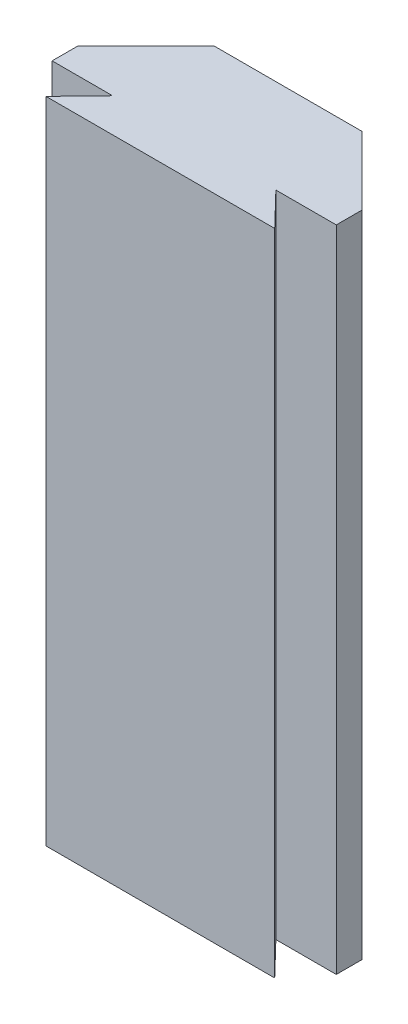
from build123d import *

# Parameters (mm, degrees)
BOSS_EXTRUDE1_DEPTH = 25.25


with BuildPart() as part:
    # Sketch1 → Boss-Extrude1 (new body)
    with BuildSketch(Plane(origin=(0, 0, 0), x_dir=(1, 0, 0), z_dir=(0, 1, 0))):
        Polygon((-2.629295399, -0.366574883), (3.120704601, -0.366574883), (5.772355031, -3.018225313), (5.772355031, -4.018225313), (3.422355031, -4.018225313), (4.693579848, -5.334617148), (-4.202170646, -5.334617148), (-2.930945828, -4.018225313), (-5.280945828, -4.018225313), (-5.280945828, -3.018225313), align=None)
    extrude(amount=BOSS_EXTRUDE1_DEPTH)


solid = part.part
